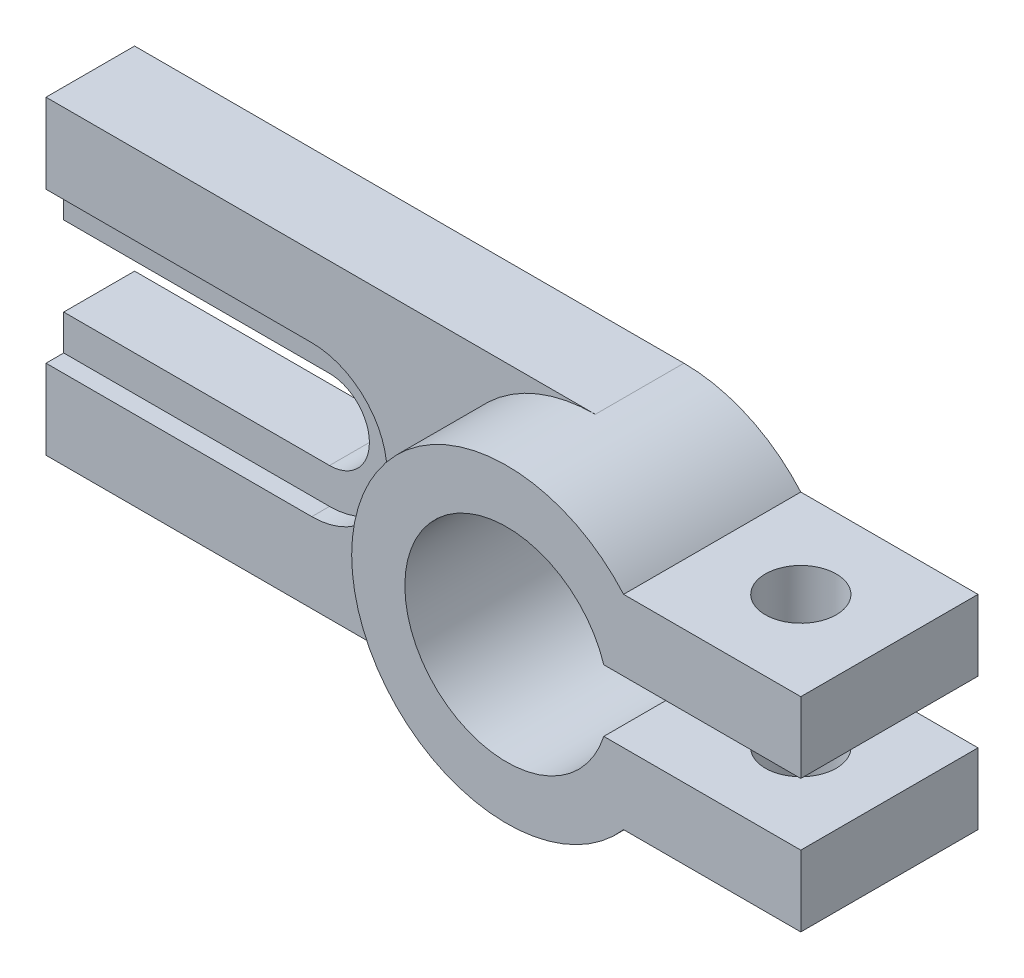
from build123d import *

# Parameters (mm, degrees)
BOSS_EXTRU_1_DEPTH      = 10
BOSS_EXTRU_2_DEPTH      = 10
ENL_V_START             = -2
ENL_V_MAT_EXTRU_1_DEPTH = 2
ESQUISSE4_R             = 4
ENL_V_MAT_EXTRU_2_DEPTH = 72.309185944


with BuildPart() as part:
    # Esquisse1 → Boss.-Extru.1 (new body)
    with BuildSketch(Plane.XY):
        with BuildLine():
            Line((-62, 17.5), (-62, 4.5))
            Line((-62, 4.5), (-32, 4.5))
            ThreePointArc((-32, 4.5), (-27.5, 0), (-32, -4.5))
            Line((-32, -4.5), (-62, -4.5))
            Line((-62, -4.5), (-62, -17.5))
            Line((-62, -17.5), (0, -17.5))
            ThreePointArc((0, -17.5), (7.245688373, -15.929532322), (13.190905958, -11.5))
            Line((13.190905958, -11.5), (33.190905958, -11.5))
            Line((33.190905958, -11.5), (33.190905958, -3.5))
            Line((33.190905958, -3.5), (10.95445115, -3.5))
            ThreePointArc((10.95445115, -3.5), (-11.5, 0), (10.95445115, 3.5))
            Line((10.95445115, 3.5), (33.190905958, 3.5))
            Line((33.190905958, 3.5), (33.190905958, 11.5))
            Line((33.190905958, 11.5), (13.190905958, 11.5))
            ThreePointArc((13.190905958, 11.5), (7.245688373, 15.929532322), (0, 17.5))
            Line((0, 17.5), (-62, 17.5))
        make_face()
    extrude(amount=BOSS_EXTRU_1_DEPTH)

    # Esquisse2 → Boss.-Extru.2 (add)
    with BuildSketch(Plane.XY.offset(10)):
        with BuildLine():
            Line((13.190905958, 11.5), (33.190905958, 11.5))
            Line((33.190905958, 11.5), (33.190905958, 3.5))
            Line((33.190905958, 3.5), (10.95445115, 3.5))
            ThreePointArc((10.95445115, 3.5), (-11.5, 0), (10.95445115, -3.5))
            Line((10.95445115, -3.5), (33.190905958, -3.5))
            Line((33.190905958, -3.5), (33.190905958, -11.5))
            Line((33.190905958, -11.5), (13.190905958, -11.5))
            ThreePointArc((13.190905958, -11.5), (-17.5, 0), (13.190905958, 11.5))
        make_face()
    extrude(amount=BOSS_EXTRU_2_DEPTH)

    # Esquisse3 → Enlèv. mat.-Extru.1 (cut)
    with BuildSketch(Plane.XY.offset(10).offset(ENL_V_START)):
        with BuildLine():
            Line((-32, 4.5), (-62, 4.5))
            Line((-62, 4.5), (-62, 8.5))
            Line((-62, 8.5), (-32, 8.5))
            ThreePointArc((-32, 8.5), (-23.5, 0), (-32, -8.5))
            Line((-32, -8.5), (-62, -8.5))
            Line((-62, -8.5), (-62, -4.5))
            Line((-62, -4.5), (-32, -4.5))
            ThreePointArc((-32, -4.5), (-27.5, 0), (-32, 4.5))
        make_face()
    extrude(amount=ENL_V_MAT_EXTRU_1_DEPTH, mode=Mode.SUBTRACT)

    # Esquisse4 → Enlèv. mat.-Extru.2 (cut, through all)
    with BuildSketch(Plane.XZ.offset(11.5)):
        with Locations((23.190905958, 10)):
            Circle(ESQUISSE4_R)
    extrude(amount=-ENL_V_MAT_EXTRU_2_DEPTH, mode=Mode.SUBTRACT)


solid = part.part
